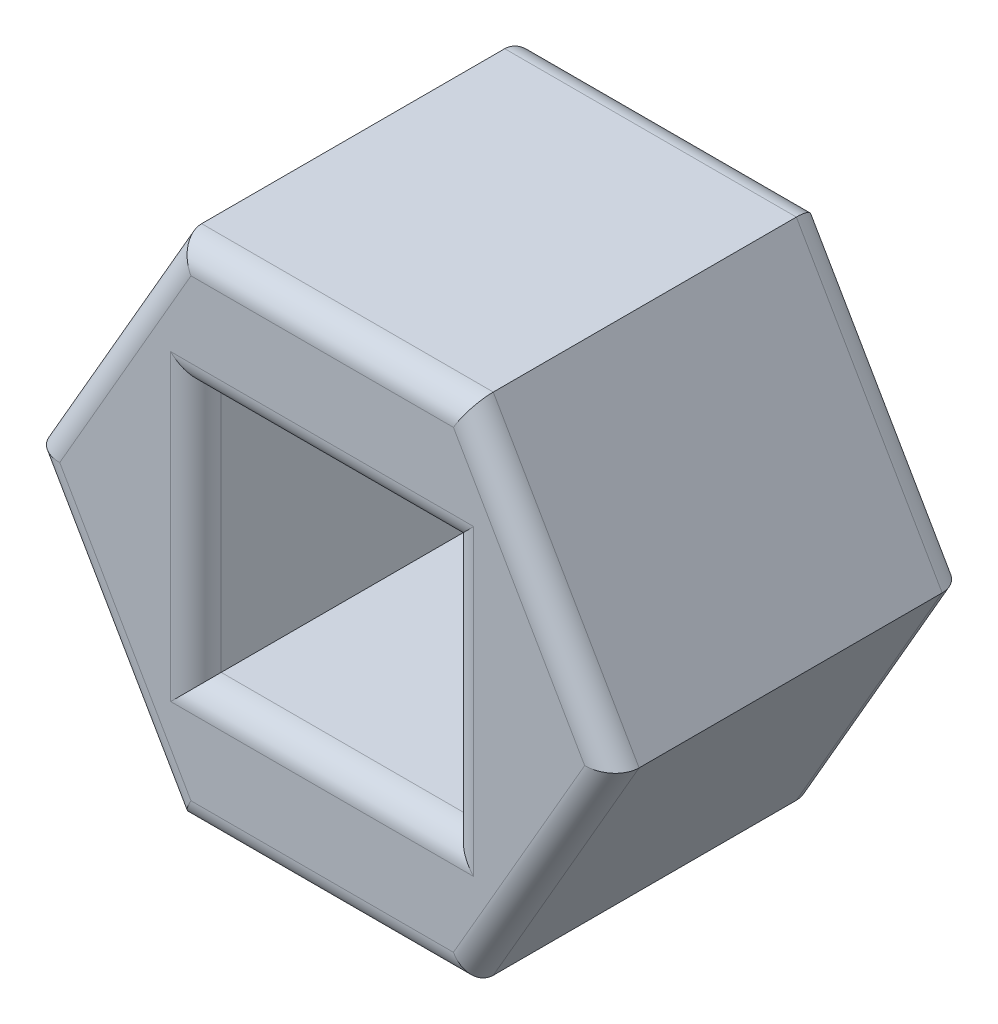
from build123d import *

# Parameters (mm, degrees)
SKETCH1_W           = 6.35
SKETCH1_H           = 6.35
BOSS_EXTRUDE1_DEPTH = 8.89
FILLET1_R           = 0.635


with BuildPart() as part:
    # Sketch1 → Boss-Extrude1 (new body)
    with BuildSketch(Plane.XY):
        Polygon((7.332348419, 0), (3.666174209, 6.35), (-3.666174209, 6.35), (-7.332348419, 0), (-3.666174209, -6.35), (3.666174209, -6.35), align=None)
        Rectangle(SKETCH1_W, SKETCH1_H, mode=Mode.SUBTRACT)
    extrude(amount=BOSS_EXTRUDE1_DEPTH)

    # Fillet1
    fillet1_edges = [part.edges().sort_by_distance(p)[0] for p in [
        (0, 6.35, 8.89),
        (-5.499261314, 3.175, 8.89),
        (3.175, 0, 0),
        (0, 3.175, 0),
        (-3.175, 0, 0),
        (-5.499261314, -3.175, 8.89),
        (0, -3.175, 0),
        (3.175, 0, 8.89),
        (0, 3.175, 8.89),
        (-3.175, 0, 8.89),
        (0, -3.175, 8.89),
        (0, -6.35, 8.89),
        (5.499261314, -3.175, 8.89),
        (0, -6.35, 0),
        (-5.499261314, -3.175, 0),
        (-5.499261314, 3.175, 0),
        (0, 6.35, 0),
        (5.499261314, 3.175, 0),
        (5.499261314, -3.175, 0),
        (5.499261314, 3.175, 8.89),
    ]]
    fillet(fillet1_edges, radius=FILLET1_R)


solid = part.part
